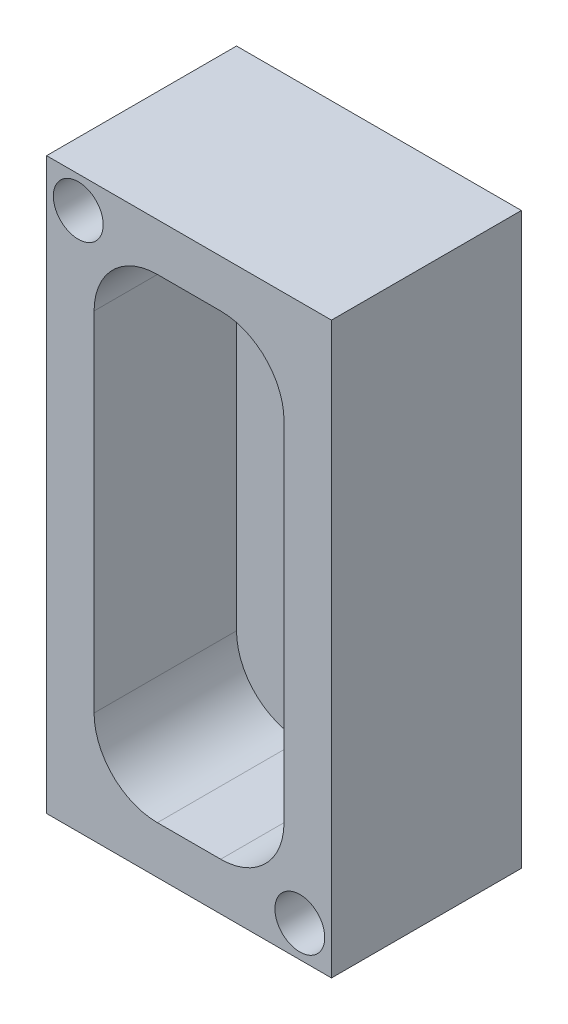
from build123d import *

# Parameters (mm, degrees)
SKETCH1_W                        = 18
SKETCH1_H                        = 36
BOSS_EXTRUDE1_DEPTH              = 12
SHELL1_T                         = -3
SKETCH1_3_R                      = 2.525
CUT_EXTRUDE1_DEPTH               = 10
SKETCH2_R                        = 2.925
CUT_EXTRUDE2_DEPTH               = 1
FILLET1_R                        = 4
TAP_DRILL_FOR_M3_HELICOIL1_D     = 3.15
TAP_DRILL_FOR_M3_HELICOIL1_DEPTH = 3.3
TAP_DRILL_FOR_M3_HELICOIL1_TIP   = 0.946355475


with BuildPart() as part:
    # Sketch1 → Boss-Extrude1 (new body)
    with BuildSketch(Plane.XY):
        Rectangle(SKETCH1_W, SKETCH1_H)
    extrude(amount=BOSS_EXTRUDE1_DEPTH)

    # Shell1
    shell1_openings = [part.faces().sort_by_distance(p)[0] for p in [
        (0, 0, 12),
    ]]
    offset(amount=SHELL1_T, openings=shell1_openings, kind=Kind.INTERSECTION)

    # Sketch1<3> → Cut-Extrude1 (cut)
    with BuildSketch(Plane.XY):
        with Locations((0, 12)):
            Circle(SKETCH1_3_R)
        Circle(SKETCH1_3_R)
        with Locations((0, -12)):
            Circle(SKETCH1_3_R)
    extrude(amount=CUT_EXTRUDE1_DEPTH, mode=Mode.SUBTRACT)

    # Sketch2 → Cut-Extrude2 (cut)
    with BuildSketch(Plane.XY.offset(3)):
        with Locations((0, 12)):
            Circle(SKETCH2_R)
        Circle(SKETCH2_R)
        with Locations((0, -12)):
            Circle(SKETCH2_R)
    extrude(amount=-CUT_EXTRUDE2_DEPTH, mode=Mode.SUBTRACT)

    # Fillet1
    fillet1_edges = [part.edges().sort_by_distance(p)[0] for p in [
        (-6, 15, 7.5),
        (6, 15, 7.5),
        (-6, -15, 7.5),
        (6, -15, 7.5),
    ]]
    fillet(fillet1_edges, radius=FILLET1_R)

    # Tap Drill for M3 Helicoil1
    with Locations(Plane.XY.offset(12)):
        with Locations((7, -16), (-7, 16)):
            Hole(TAP_DRILL_FOR_M3_HELICOIL1_D / 2, depth=TAP_DRILL_FOR_M3_HELICOIL1_DEPTH)
            with Locations((0, 0, -(TAP_DRILL_FOR_M3_HELICOIL1_DEPTH + TAP_DRILL_FOR_M3_HELICOIL1_TIP / 2))):  # 118° drill point
                Cone(0, TAP_DRILL_FOR_M3_HELICOIL1_D / 2, TAP_DRILL_FOR_M3_HELICOIL1_TIP, mode=Mode.SUBTRACT)


solid = part.part
